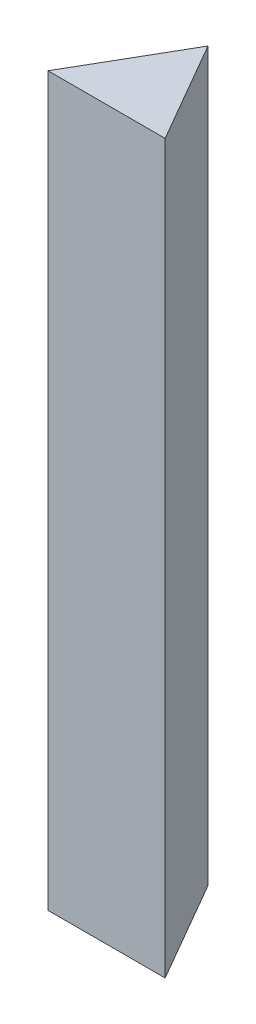
from build123d import *

# Parameters (mm, degrees)
BOSS_EXTRUDE1_DEPTH = 29.8


with BuildPart() as part:
    # Sketch1 → Boss-Extrude1 (new body)
    with BuildSketch(Plane(origin=(0, 0, 0), x_dir=(1, 0, 0), z_dir=(0, 1, 0))):
        Polygon((-2.4, 0), (0, 4.156921938), (2.4, 0), align=None)
    extrude(amount=BOSS_EXTRUDE1_DEPTH)


solid = part.part
